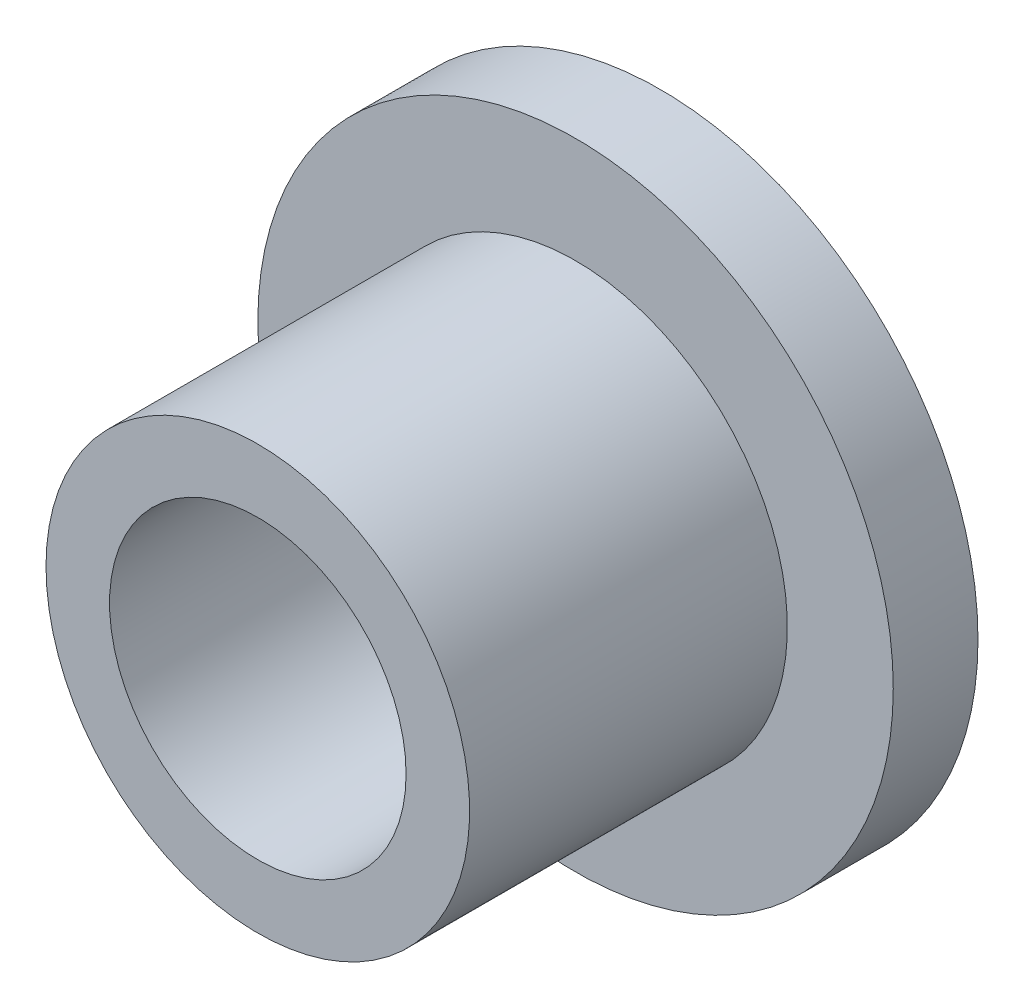
from build123d import *

# Parameters (mm, degrees)
SKETCH1_R           = 19.05
BOSS_EXTRUDE1_DEPTH = 5.08
SKETCH2_R           = 12.7
BOSS_EXTRUDE2_DEPTH = 19.05
CUT_EXTRUDE1_REACH  = 38.167
SKETCH3_R           = 8.89


with BuildPart() as part:
    # Sketch1 → Boss-Extrude1 (new body)
    with BuildSketch(Plane.XY):
        Circle(SKETCH1_R)
    extrude(amount=-BOSS_EXTRUDE1_DEPTH)

    # Sketch2 → Boss-Extrude2 (add)
    with BuildSketch(Plane.XY):
        with Locations(Location((0, 0, 0), (0, 0, 180))):
            Circle(SKETCH2_R)
    extrude(amount=BOSS_EXTRUDE2_DEPTH)

    # Sketch3 → Cut-Extrude1 (cut, up to next)
    with BuildSketch(Plane.XY.offset(19.05), mode=Mode.PRIVATE) as cut_extrude1_sk1:
        Circle(SKETCH3_R)
    cut_extrude1_tool1 = extrude(cut_extrude1_sk1.sketch, amount=-CUT_EXTRUDE1_REACH, mode=Mode.PRIVATE) & part.part
    add(cut_extrude1_tool1.solids().sort_by_distance((0, 0, 19.05))[0], mode=Mode.SUBTRACT)


solid = part.part
